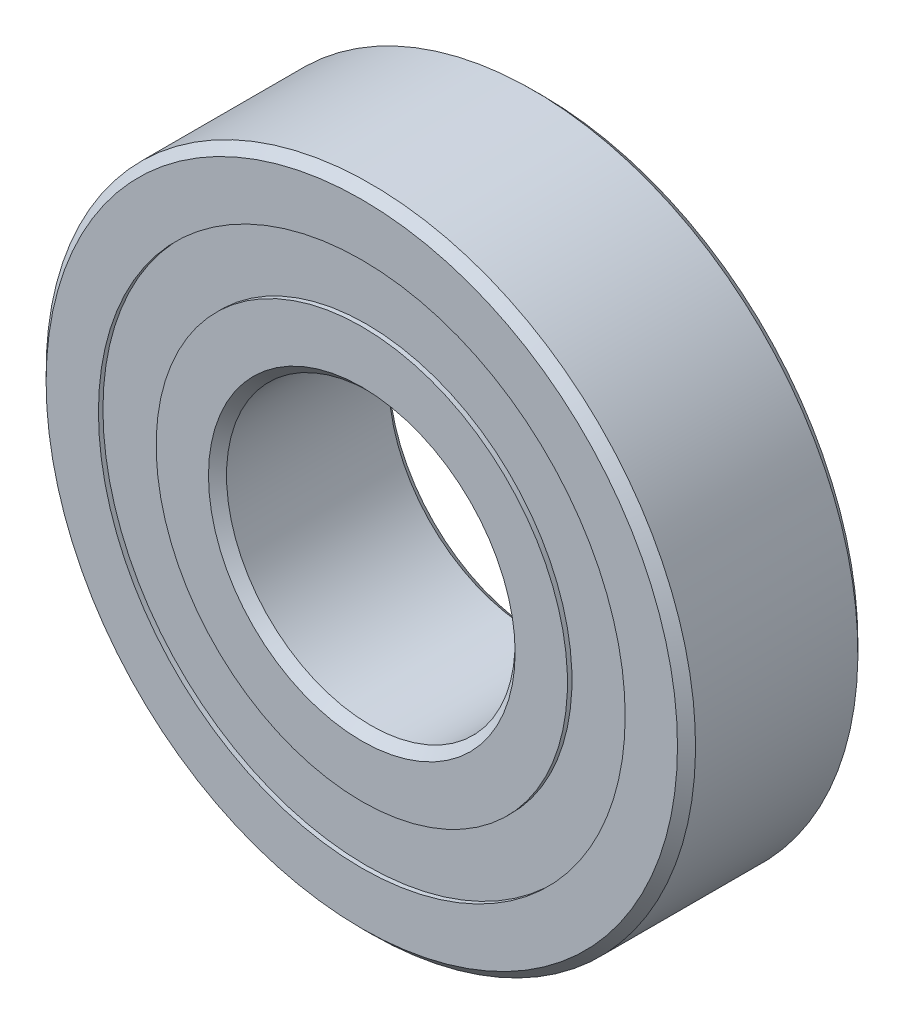
from build123d import *

# Parameters (mm, degrees)
CIRPATTERN1_COUNT = 8
SKETCH6_W         = 1.59678909
SKETCH6_H         = 2.54


with BuildPart() as part:
    # Sketch3 → Revolve1 (revolve)
    with BuildSketch(Plane(origin=(0, 0, 0), x_dir=(0, 0, -1), z_dir=(1, 0, 0)), mode=Mode.PRIVATE) as revolve1_sk:
        with BuildLine():
            Line((3.571875, 14.2875), (3.96875, 13.890625))
            Line((3.96875, 13.890625), (3.96875, 11.58875))
            Line((3.96875, 11.58875), (1.763888889, 11.58875))
            ThreePointArc((1.763888889, 11.58875), (0, 12.49227341), (-1.763888889, 11.58875))
            Line((-1.763888889, 11.58875), (-3.96875, 11.58875))
            Line((-3.96875, 11.58875), (-3.96875, 13.890625))
            Line((-3.96875, 13.890625), (-3.571875, 14.2875))
            Line((-3.571875, 14.2875), (3.571875, 14.2875))
        make_face()
    revolve(revolve1_sk.sketch.rotate(Axis((0, 0, 3.96875), (0, 0, -1)), 180), axis=Axis((0, 0, 3.96875), (0, 0, -1)))


with BuildPart() as body_2:
    # Sketch4 → Revolve2 (revolve)
    with BuildSketch(Plane(origin=(0, 0, 0), x_dir=(0, 0, -1), z_dir=(1, 0, 0)), mode=Mode.PRIVATE) as revolve2_sk:
        with BuildLine():
            Line((-3.571875, 6.35), (-3.96875, 6.746875))
            Line((-3.96875, 6.746875), (-3.96875, 9.04875))
            Line((-3.96875, 9.04875), (-1.763888889, 9.04875))
            ThreePointArc((-1.763888889, 9.04875), (0, 8.14522659), (1.763888889, 9.04875))
            Line((1.763888889, 9.04875), (3.96875, 9.04875))
            Line((3.96875, 9.04875), (3.96875, 6.746875))
            Line((3.96875, 6.746875), (3.571875, 6.35))
            Line((3.571875, 6.35), (-3.571875, 6.35))
        make_face()
    revolve(revolve2_sk.sketch.rotate(Axis((0, 0, 3.96875), (0, 0, -1)), 180), axis=Axis((0, 0, 3.96875), (0, 0, -1)))


with BuildPart() as body_3:
    # Sketch5 → Revolve3 (revolve)
    with BuildSketch(Plane(origin=(0, 0, 0), x_dir=(0, 0, -1), z_dir=(1, 0, 0))):
        with BuildLine():
            Line((-2.17352341, 10.31875), (2.17352341, 10.31875))
            ThreePointArc((2.17352341, 10.31875), (0, 12.49227341), (-2.17352341, 10.31875))
        make_face()
    revolve(axis=Axis((0, 10.31875, 2.17352341), (0, 0, -1)))


with BuildPart() as cirpattern1_1:
    # CirPattern1: pattern copy
    add(body_3.part.rotate(Axis((0, 0, 0), (0, 0, 1)), 1 * 360 / CIRPATTERN1_COUNT))


with BuildPart() as cirpattern1_2:
    # CirPattern1: pattern copy
    add(body_3.part.rotate(Axis((0, 0, 0), (0, 0, 1)), 2 * 360 / CIRPATTERN1_COUNT))


with BuildPart() as cirpattern1_3:
    # CirPattern1: pattern copy
    add(body_3.part.rotate(Axis((0, 0, 0), (0, 0, 1)), 3 * 360 / CIRPATTERN1_COUNT))


with BuildPart() as cirpattern1_4:
    # CirPattern1: pattern copy
    add(body_3.part.rotate(Axis((0, 0, 0), (0, 0, 1)), 4 * 360 / CIRPATTERN1_COUNT))


with BuildPart() as cirpattern1_5:
    # CirPattern1: pattern copy
    add(body_3.part.rotate(Axis((0, 0, 0), (0, 0, 1)), 5 * 360 / CIRPATTERN1_COUNT))


with BuildPart() as cirpattern1_6:
    # CirPattern1: pattern copy
    add(body_3.part.rotate(Axis((0, 0, 0), (0, 0, 1)), 6 * 360 / CIRPATTERN1_COUNT))


with BuildPart() as cirpattern1_7:
    # CirPattern1: pattern copy
    add(body_3.part.rotate(Axis((0, 0, 0), (0, 0, 1)), 7 * 360 / CIRPATTERN1_COUNT))


with BuildPart() as body_11:
    # Sketch6 → Revolve4 (revolve)
    with BuildSketch(Plane(origin=(0, 0, 0), x_dir=(0, 0, -1), z_dir=(1, 0, 0)), mode=Mode.PRIVATE) as revolve4_sk:
        with Locations((-2.971917955, 10.31875)):
            Rectangle(SKETCH6_W, SKETCH6_H)
        with Locations((2.971917955, 10.31875)):
            Rectangle(SKETCH6_W, SKETCH6_H)
    revolve(revolve4_sk.sketch.rotate(Axis((0, 0, 3.96875), (0, 0, -1)), 180), axis=Axis((0, 0, 3.96875), (0, 0, -1)))


solid = Compound([part.part, body_2.part, body_3.part, cirpattern1_1.part, cirpattern1_2.part, cirpattern1_3.part, cirpattern1_4.part, cirpattern1_5.part, cirpattern1_6.part, cirpattern1_7.part, body_11.part])
